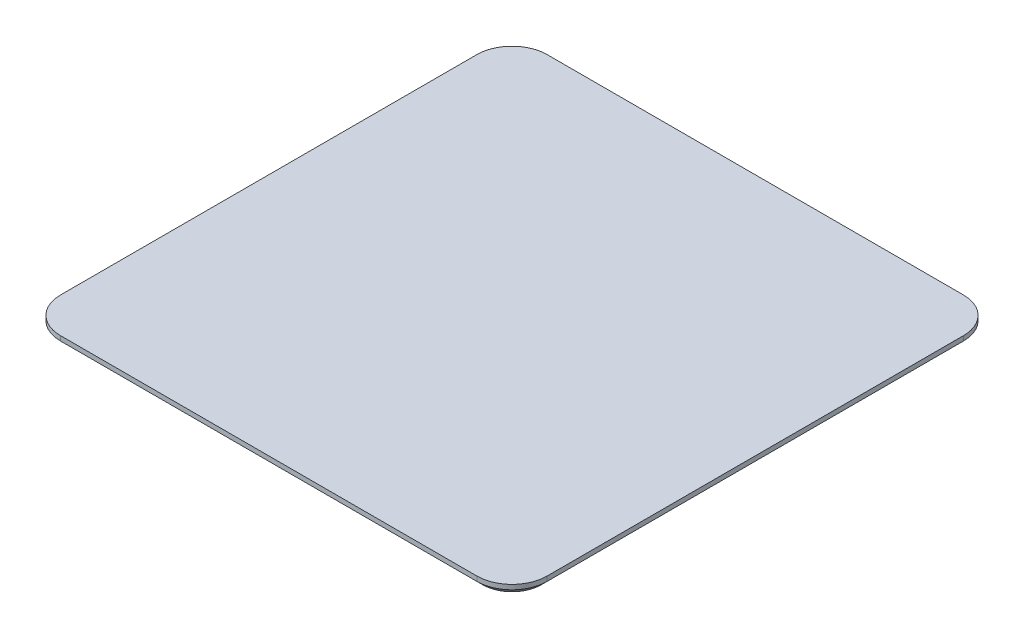
from build123d import *

# Parameters (mm, degrees)
SKETCH_1_W      = 41.5
SKETCH_1_H      = 41.5
EXTRUDE_1_DEPTH = 0.9
FILLET_1_R      = 3
CHAMFER_1_SIZE  = 0.5


with BuildPart() as part:
    # Эскиз1 → Бобышка-Вытянуть1 (new body)
    with BuildSketch(Plane(origin=(0, 0, 0), x_dir=(1, 0, 0), z_dir=(0, 1, 0))):
        Rectangle(SKETCH_1_W, SKETCH_1_H)
    extrude(amount=EXTRUDE_1_DEPTH)

    # Скругление1
    fillet_1_edges = [part.edges().sort_by_distance(p)[0] for p in [
        (20.75, 0.45, 20.75),
        (-20.75, 0.45, 20.75),
        (-20.75, 0.45, -20.75),
        (20.75, 0.45, -20.75),
    ]]
    fillet(fillet_1_edges, radius=FILLET_1_R)

    # Фаска1
    chamfer_1_edges = [part.edges().sort_by_distance(p)[0] for p in [
        (-20.75, 0, 0),
        (20.75, 0, 0),
        (0, 0, 20.75),
        (0, 0, -20.75),
        (19.871320344, 0, 19.871320344),
        (19.871320344, 0, -19.871320344),
        (-19.871320344, 0, 19.871320344),
        (-19.871320344, 0, -19.871320344),
    ]]
    chamfer(chamfer_1_edges, length=CHAMFER_1_SIZE)


solid = part.part
